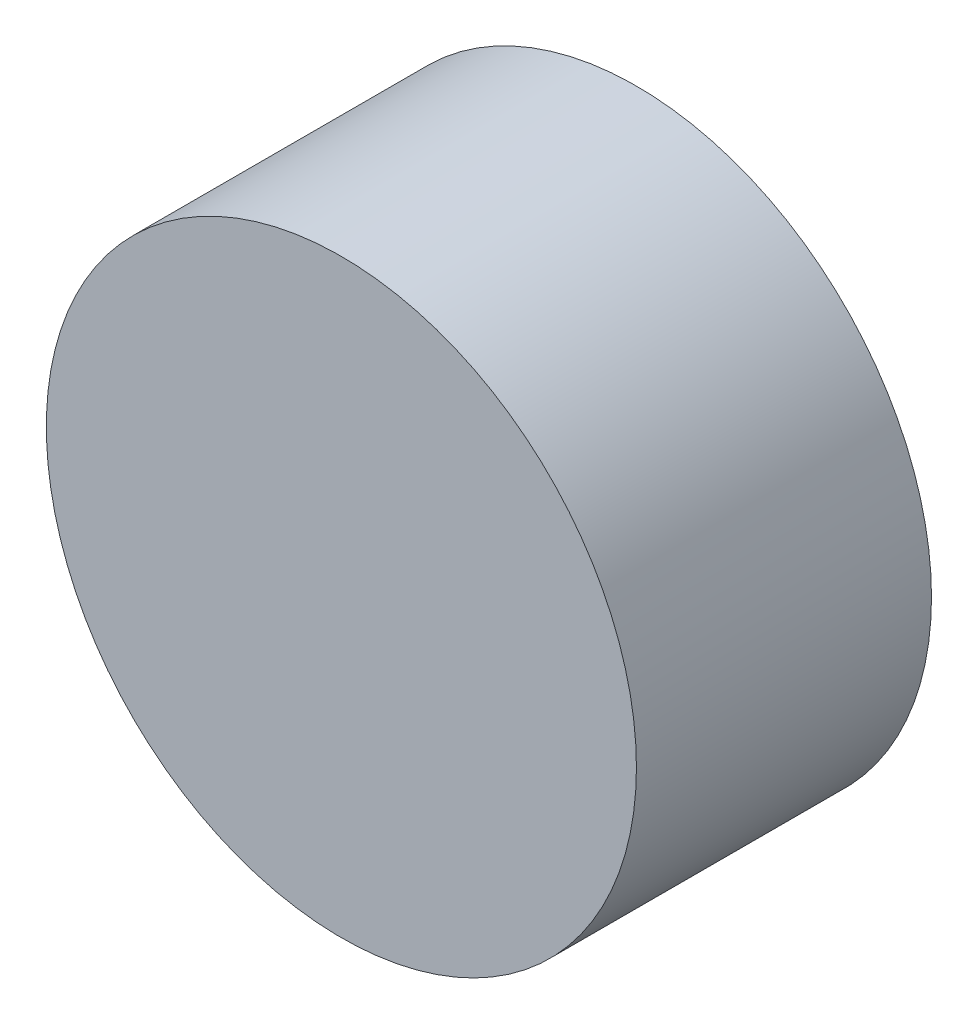
from build123d import *

# Parameters (mm, degrees)
SKETCH1_R     = 7
PROFILE_DEPTH = 7


with BuildPart() as part:
    # Sketch1 → Profile (new body)
    with BuildSketch(Plane.XY):
        with Locations((7, 7)):
            Circle(SKETCH1_R)
    extrude(amount=PROFILE_DEPTH)


solid = part.part
